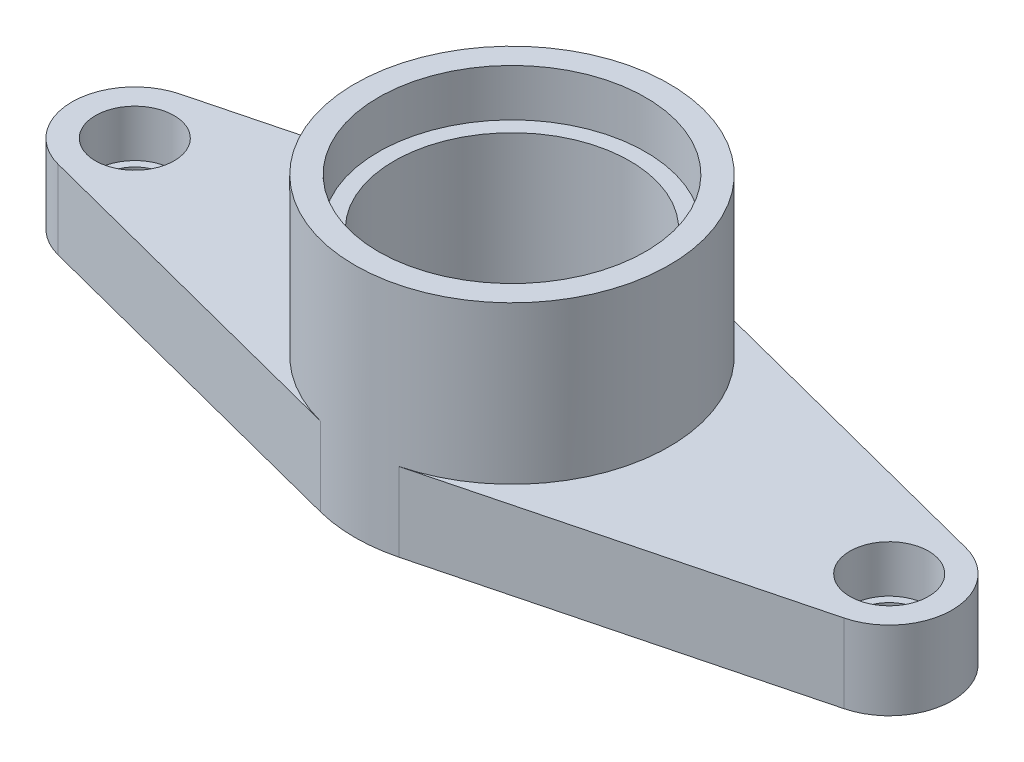
from build123d import *
from build123d.topology import SkipClean

# Parameters (mm, degrees)
BOSS_EXTRUDE1_DEPTH = 25
SKETCH2_R           = 50
BOSS_EXTRUDE2_DEPTH = 50
SKETCH3_R           = 42.5
CUT_EXTRUDE1_DEPTH  = 15
SKETCH4_R           = 37.5
CUT_EXTRUDE2_DEPTH  = 161.312195419
SKETCH5_R           = 12.5
CUT_EXTRUDE3_DEPTH  = 15
SKETCH6_R           = 10
CUT_EXTRUDE4_DEPTH  = 157.843871414


with BuildPart() as part:
    # Sketch1 → Boss-Extrude1 (new body)
    with BuildSketch(Plane(origin=(0, 0, 0), x_dir=(1, 0, 0), z_dir=(0, 1, 0))):
        with BuildLine():
            Line((-125, 19.364916731), (-12.5, 48.412291828))
            ThreePointArc((-12.5, 48.412291828), (0, 50), (12.5, 48.412291828))
            Line((12.5, 48.412291828), (125, 19.364916731))
            ThreePointArc((125, 19.364916731), (140, 0), (125, -19.364916731))
            Line((125, -19.364916731), (12.5, -48.412291828))
            ThreePointArc((12.5, -48.412291828), (0, -50), (-12.5, -48.412291828))
            Line((-12.5, -48.412291828), (-125, -19.364916731))
            ThreePointArc((-125, -19.364916731), (-140, 0), (-125, 19.364916731))
        make_face()
    extrude(amount=BOSS_EXTRUDE1_DEPTH)

    # Sketch2 → Boss-Extrude2 (add)
    with SkipClean():  # the faces are left unmerged after this step: merging them gives an invalid solid
        with BuildSketch(Plane(origin=(0, 25, 0), x_dir=(1, 0, 0), z_dir=(0, 1, 0))):
            with Locations(Location((0, 0, 0), (0, 0, 75.522487814))):
                Circle(SKETCH2_R)
        extrude(amount=BOSS_EXTRUDE2_DEPTH)

    # Sketch3 → Cut-Extrude1 (cut)
    with SkipClean():  # the faces are left unmerged after this step: merging them gives an invalid solid
        with BuildSketch(Plane(origin=(0, 75, 0), x_dir=(1, 0, 0), z_dir=(0, 1, 0))):
            with Locations(Location((0, 0, 0), (0, 0, 270))):
                Circle(SKETCH3_R)
        extrude(amount=-CUT_EXTRUDE1_DEPTH, mode=Mode.SUBTRACT)

    # Sketch4 → Cut-Extrude2 (cut, through all)
    with SkipClean():  # the faces are left unmerged after this step: merging them gives an invalid solid
        with BuildSketch(Plane(origin=(0, 60, 0), x_dir=(1, 0, 0), z_dir=(0, 1, 0))):
            with Locations(Location((0, 0, 0), (0, 0, 270))):
                Circle(SKETCH4_R)
        extrude(amount=-CUT_EXTRUDE2_DEPTH, mode=Mode.SUBTRACT)

    # Sketch5 → Cut-Extrude3 (cut)
    with SkipClean():  # the faces are left unmerged after this step: merging them gives an invalid solid
        with BuildSketch(Plane(origin=(0, 25, 0), x_dir=(1, 0, 0), z_dir=(0, 1, 0))):
            with Locations(Location((-120, 0, 0), (0, 0, 270))):
                Circle(SKETCH5_R)
            with Locations(Location((120, 0, 0), (0, 0, 90))):
                Circle(SKETCH5_R)
        extrude(amount=-CUT_EXTRUDE3_DEPTH, mode=Mode.SUBTRACT)

    # Sketch6 → Cut-Extrude4 (cut, through all)
    with SkipClean():  # the faces are left unmerged after this step: merging them gives an invalid solid
        with BuildSketch(Plane(origin=(0, 25, 0), x_dir=(1, 0, 0), z_dir=(0, 1, 0))):
            with Locations(Location((-120, 0, 0), (0, 0, 270))):
                Circle(SKETCH6_R)
            with Locations(Location((120, 0, 0), (0, 0, 90))):
                Circle(SKETCH6_R)
        extrude(amount=-CUT_EXTRUDE4_DEPTH, mode=Mode.SUBTRACT)


solid = part.part
